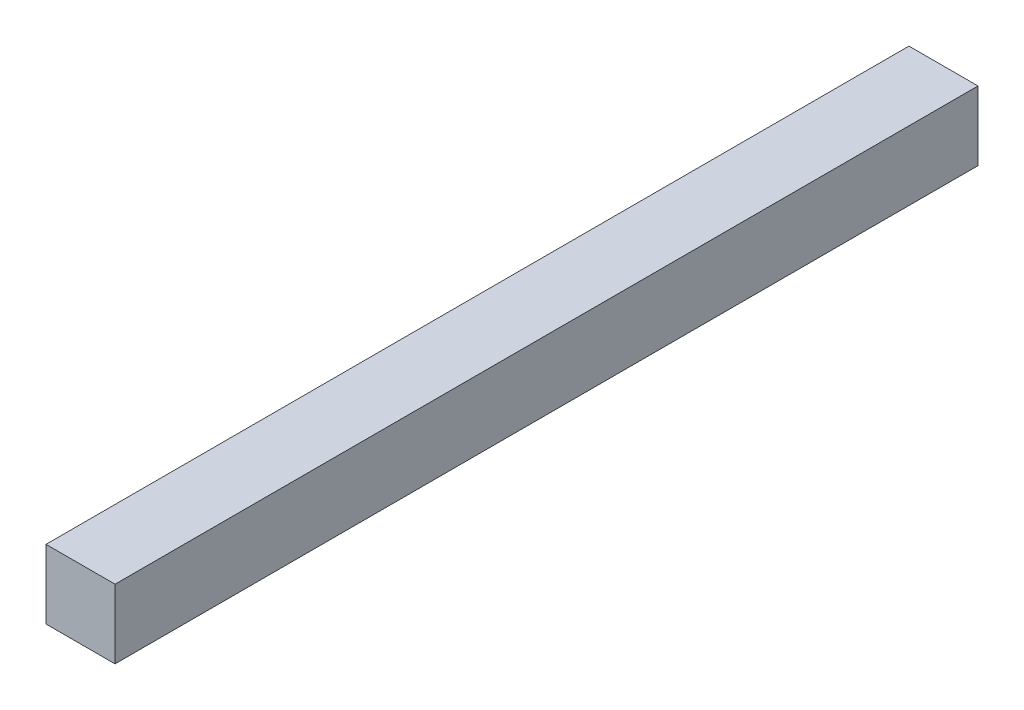
from build123d import *

# Parameters (mm, degrees)
SKETCH_1_W      = 80
SKETCH_1_H      = 80
EXTRUDE_1_DEPTH = 1000


with BuildPart() as part:
    # ｽｹｯﾁ1 → ﾎﾞｽ - 押し出し1 (new body)
    with BuildSketch(Plane.XY):
        with Locations((40, 40)):
            Rectangle(SKETCH_1_W, SKETCH_1_H)
    extrude(amount=EXTRUDE_1_DEPTH)


solid = part.part
